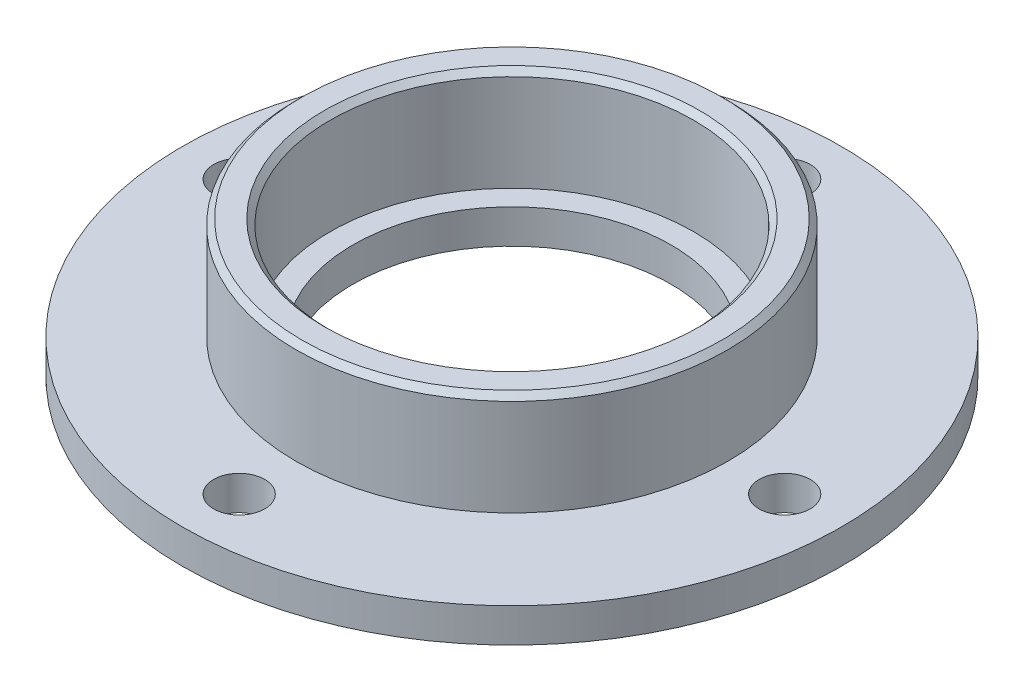
from build123d import *

# Parameters (mm, degrees)
SKETCH1_R            = 29
SKETCH1_R_2          = 14
SKETCH1_R_3          = 1
BOSS_EXTRUDE1_DEPTH  = 3
SKETCH2_R            = 19
SKETCH2_R_2          = 16
BOSS_EXTRUDE2_DEPTH  = 9
M4_CLEARANCE_HOLE1_D = 4.5
CHAMFER1_SIZE        = 0.5


with BuildPart() as part:
    # Sketch1 → Boss-Extrude1 (new body)
    with BuildSketch(Plane(origin=(0, 0, 0), x_dir=(1, 0, 0), z_dir=(0, 1, 0))):
        with Locations(Location((0, 0, 0), (0, 0, 270))):
            Circle(SKETCH1_R)
        with Locations(Location((0, 0, 0), (0, 0, 270))):
            Circle(SKETCH1_R_2, mode=Mode.SUBTRACT)
        with Locations(Location((0, 24, 0), (0, 0, 270))):
            Circle(SKETCH1_R_3, mode=Mode.SUBTRACT)
        with Locations(Location((24, 0, 0), (0, 0, 270))):
            Circle(SKETCH1_R_3, mode=Mode.SUBTRACT)
        with Locations(Location((0, -24, 0), (0, 0, 270))):
            Circle(SKETCH1_R_3, mode=Mode.SUBTRACT)
        with Locations(Location((-24, 0, 0), (0, 0, 270))):
            Circle(SKETCH1_R_3, mode=Mode.SUBTRACT)
    extrude(amount=BOSS_EXTRUDE1_DEPTH)

    # Sketch2 → Boss-Extrude2 (add)
    with BuildSketch(Plane(origin=(0, 3, 0), x_dir=(1, 0, 0), z_dir=(0, 1, 0))):
        with Locations(Location((0, 0, 0), (0, 0, 270))):
            Circle(SKETCH2_R)
        with Locations(Location((0, 0, 0), (0, 0, 270))):
            Circle(SKETCH2_R_2, mode=Mode.SUBTRACT)
    extrude(amount=BOSS_EXTRUDE2_DEPTH)

    # M4 Clearance Hole1 (through all)
    with Locations(Plane(origin=(0, 3, 0), x_dir=(1, 0, 0), z_dir=(0, 1, 0))):
        with Locations((0, 24), (24, 0), (0, -24), (-24, 0)):
            Hole(M4_CLEARANCE_HOLE1_D / 2)

    # Chamfer1
    chamfer1_edges = [part.edges().sort_by_distance(p)[0] for p in [
        (0, 12, -19),
        (0, 12, -16),
    ]]
    chamfer(chamfer1_edges, length=CHAMFER1_SIZE)


solid = part.part
